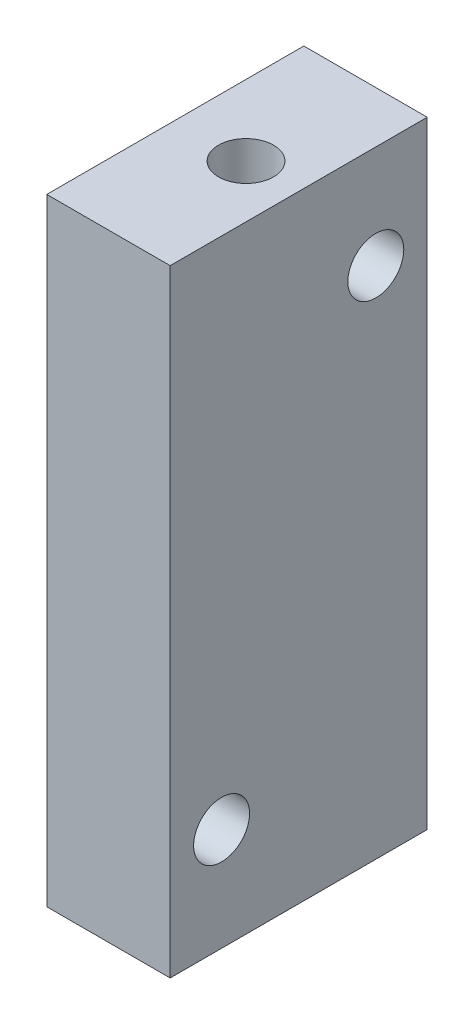
from build123d import *

# Parameters (mm, degrees)
SKETCH1_W               = 38.1
SKETCH1_H               = 15.875
BOSS_EXTRUDE1_DEPTH     = 7.62
SKETCH3_R               = 1.7
CUT_EXTRUDE1_DEPTH      = 49.4665
CUT_EXTRUDE2_DEPTH      = 3.302
CUT_EXTRUDE2_DEPTH_BACK = 22.2885
SKETCH4_R               = 1.7272


with BuildPart() as part:
    # Sketch1 → Boss-Extrude1 (new body)
    with BuildSketch(Plane.YZ):
        Rectangle(SKETCH1_W, SKETCH1_H)
    extrude(amount=BOSS_EXTRUDE1_DEPTH)

    # Sketch3 → Cut-Extrude1 (cut)
    with BuildSketch(Plane.XZ.offset(19.05)):
        with Locations(Location((4.36625, 0, 0), (0, 0, 270))):
            Circle(SKETCH3_R)
    extrude(amount=-CUT_EXTRUDE1_DEPTH, mode=Mode.SUBTRACT)

    # Sketch4 → Cut-Extrude2 (cut, two sides: drawn at the far end of the back side and taken through both)
    with BuildSketch(Plane.YZ.offset(7.62).offset(-CUT_EXTRUDE2_DEPTH_BACK)):
        with Locations(Location((-12.7, 4.7625, 0), (0, 0, 270))):
            Circle(SKETCH4_R)
        with Locations(Location((12.7, -4.7625, 0), (0, 0, 270))):
            Circle(SKETCH4_R)
    extrude(amount=CUT_EXTRUDE2_DEPTH + CUT_EXTRUDE2_DEPTH_BACK, mode=Mode.SUBTRACT)


solid = part.part
